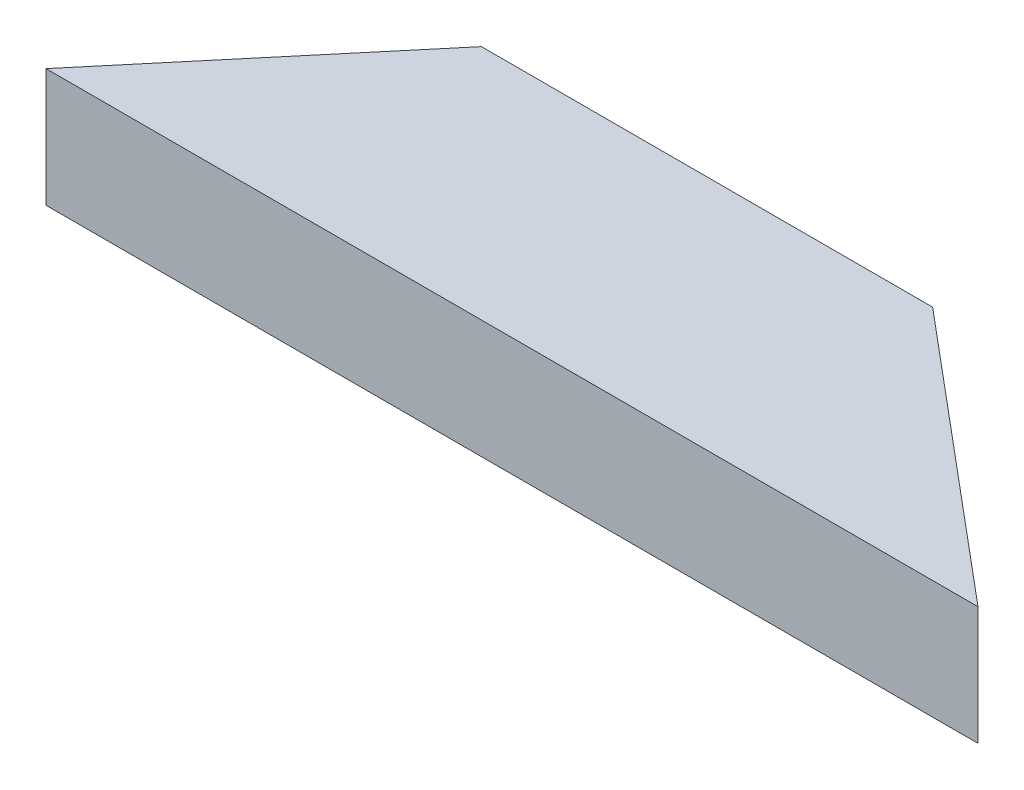
from build123d import *

# Parameters (mm, degrees)
BOSS_EXTRUDE1_DEPTH = 50.8


with BuildPart() as part:
    # Sketch1 → Boss-Extrude1 (new body)
    with BuildSketch(Plane(origin=(0, 0, 0), x_dir=(1, 0, 0), z_dir=(0, 1, 0))):
        Polygon((0, 0), (400, 0), (278.932961343, 101.6), (85.263174143, 101.6), align=None)
    extrude(amount=BOSS_EXTRUDE1_DEPTH)


solid = part.part
